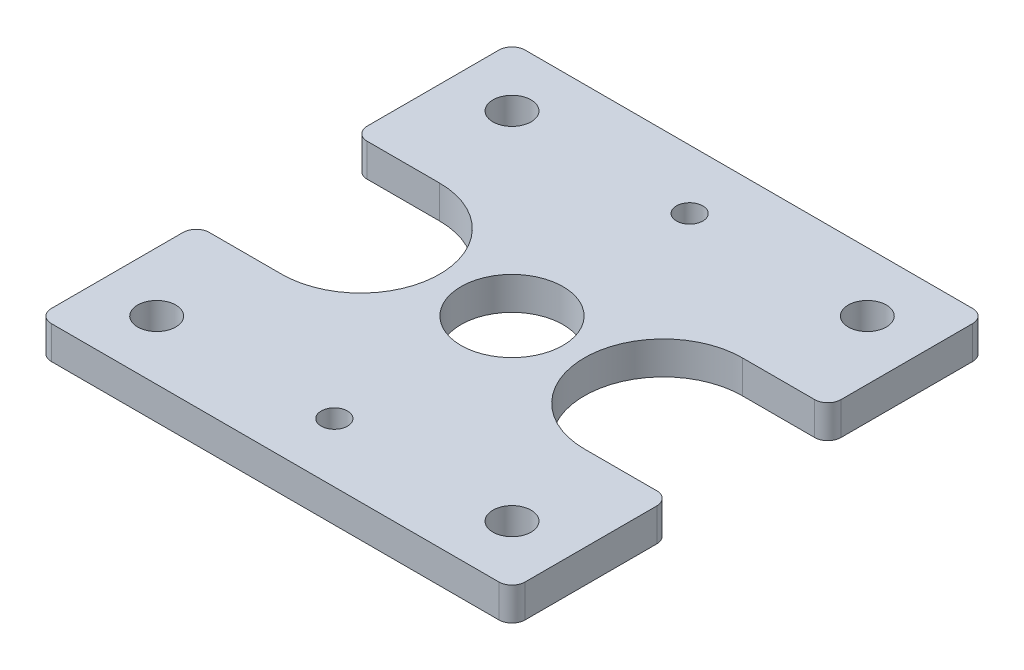
from build123d import *

# Parameters (mm, degrees)
SKETCH2_R           = 7.75
SKETCH2_R_2         = 2.9
SKETCH2_R_3         = 2
BOSS_EXTRUDE1_DEPTH = 5
FILLET1_R           = 2
FILLET2_R           = 2


with BuildPart() as part:
    # Sketch2 → Boss-Extrude1 (new body)
    with BuildSketch(Plane(origin=(0, 0, 0), x_dir=(1, 0, 0), z_dir=(0, 1, 0))):
        with BuildLine():
            Line((-36, 12), (-36, 36))
            Line((-36, 36), (36, 36))
            Line((36, 36), (36, 12))
            Line((36, 12), (23, 12))
            ThreePointArc((23, 12), (11, 0), (23, -12))
            Line((23, -12), (36, -12))
            Line((36, -12), (36, -36))
            Line((36, -36), (-36, -36))
            Line((-36, -36), (-36, -12))
            Line((-36, -12), (-23, -12))
            ThreePointArc((-23, -12), (-11, 0), (-23, 12))
            Line((-23, 12), (-36, 12))
        make_face()
        with Locations(Location((0, 0, 0), (0, 0, 270))):
            Circle(SKETCH2_R, mode=Mode.SUBTRACT)
        with Locations(Location((-27, 27, 0), (0, 0, 270))):
            Circle(SKETCH2_R_2, mode=Mode.SUBTRACT)
        with Locations(Location((27, 27, 0), (0, 0, 270))):
            Circle(SKETCH2_R_2, mode=Mode.SUBTRACT)
        with Locations(Location((27, -27, 0), (0, 0, 270))):
            Circle(SKETCH2_R_2, mode=Mode.SUBTRACT)
        with Locations(Location((-27, -27, 0), (0, 0, 270))):
            Circle(SKETCH2_R_2, mode=Mode.SUBTRACT)
        with Locations(Location((0, -27, 0), (0, 0, 270))):
            Circle(SKETCH2_R_3, mode=Mode.SUBTRACT)
        with Locations(Location((0, 27, 0), (0, 0, 270))):
            Circle(SKETCH2_R_3, mode=Mode.SUBTRACT)
    extrude(amount=BOSS_EXTRUDE1_DEPTH)

    # Fillet1
    fillet1_edges = [part.edges().sort_by_distance(p)[0] for p in [
        (36, 2.5, 36),
        (-36, 2.5, 36),
        (-36, 2.5, -36),
        (36, 2.5, -36),
    ]]
    fillet(fillet1_edges, radius=FILLET1_R)

    # Fillet2
    fillet2_edges = [part.edges().sort_by_distance(p)[0] for p in [
        (36, 2.5, -12),
        (36, 2.5, 12),
        (-36, 2.5, 12),
        (-36, 2.5, -12),
    ]]
    fillet(fillet2_edges, radius=FILLET2_R)


solid = part.part
